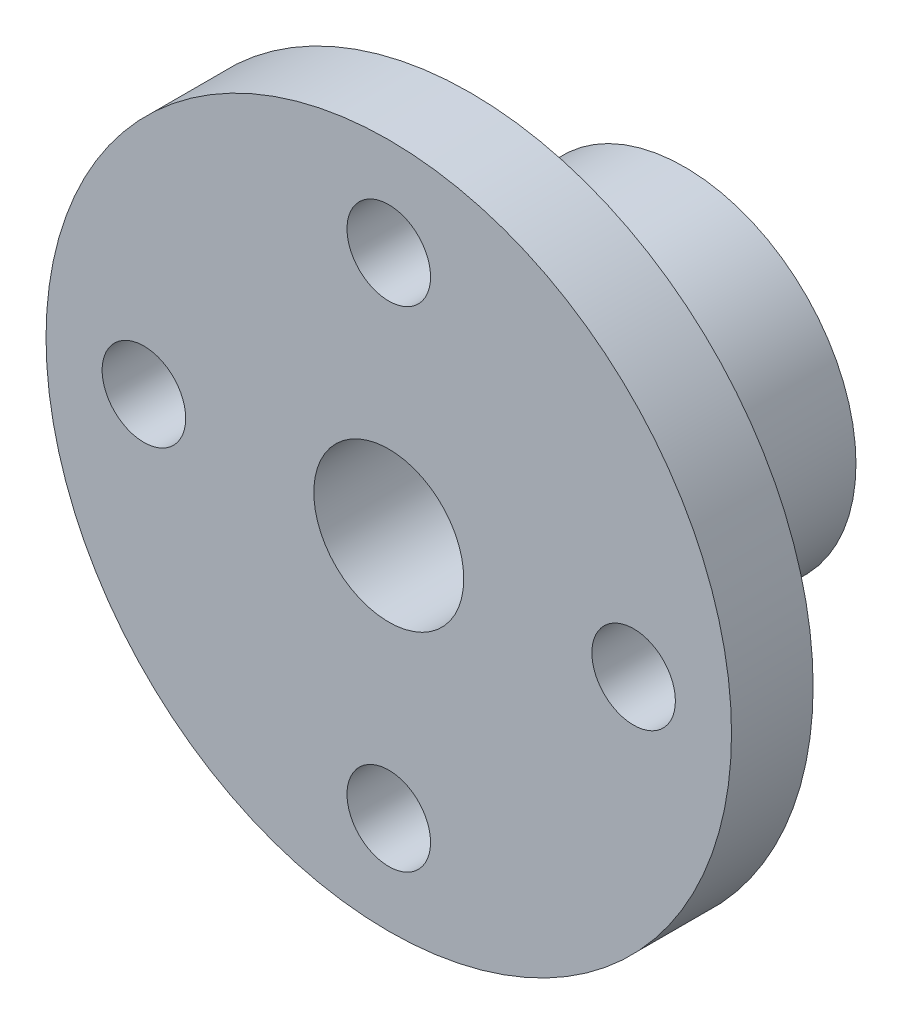
from build123d import *

# Parameters (mm, degrees)
SKETCH1_R           = 8
SKETCH1_R_2         = 3.5
BOSS_EXTRUDE1_DEPTH = 10
SKETCH2_R           = 16
SKETCH2_R_2         = 3.5
BOSS_EXTRUDE2_DEPTH = 3.81
SKETCH3_R           = 1.95
CUT_EXTRUDE1_DEPTH  = 27.508792881
SKETCH4_R           = 2
CUT_EXTRUDE2_DEPTH  = 27.508792881


with BuildPart() as part:
    # Sketch1 → Boss-Extrude1 (new body)
    with BuildSketch(Plane.XY):
        Circle(SKETCH1_R)
        Circle(SKETCH1_R_2, mode=Mode.SUBTRACT)
    extrude(amount=BOSS_EXTRUDE1_DEPTH)

    # Sketch2 → Boss-Extrude2 (add)
    with BuildSketch(Plane.XY.offset(10)):
        with Locations(Location((0, 0, 0), (0, 0, 180))):
            Circle(SKETCH2_R)
        Circle(SKETCH2_R_2, mode=Mode.SUBTRACT)
    extrude(amount=BOSS_EXTRUDE2_DEPTH)

    # Sketch3 → Cut-Extrude1 (cut, through all)
    with BuildSketch(Plane.XY.offset(13.81)):
        with Locations((0, 11.43)):
            Circle(SKETCH3_R)
        with Locations((11.43, 0)):
            Circle(SKETCH3_R)
        with Locations((0, -11.43)):
            Circle(SKETCH3_R)
        with Locations((-11.43, 0)):
            Circle(SKETCH3_R)
    extrude(amount=-CUT_EXTRUDE1_DEPTH, mode=Mode.SUBTRACT)

    # Sketch4 → Cut-Extrude2 (cut, through all)
    with BuildSketch(Plane(origin=(0, 0, 0), x_dir=(1, 0, 0), z_dir=(0, 1, 0))):
        with Locations(Location((0, -5, 0), (0, 0, 270))):
            Circle(SKETCH4_R)
    extrude(amount=-CUT_EXTRUDE2_DEPTH, mode=Mode.SUBTRACT)


solid = part.part
